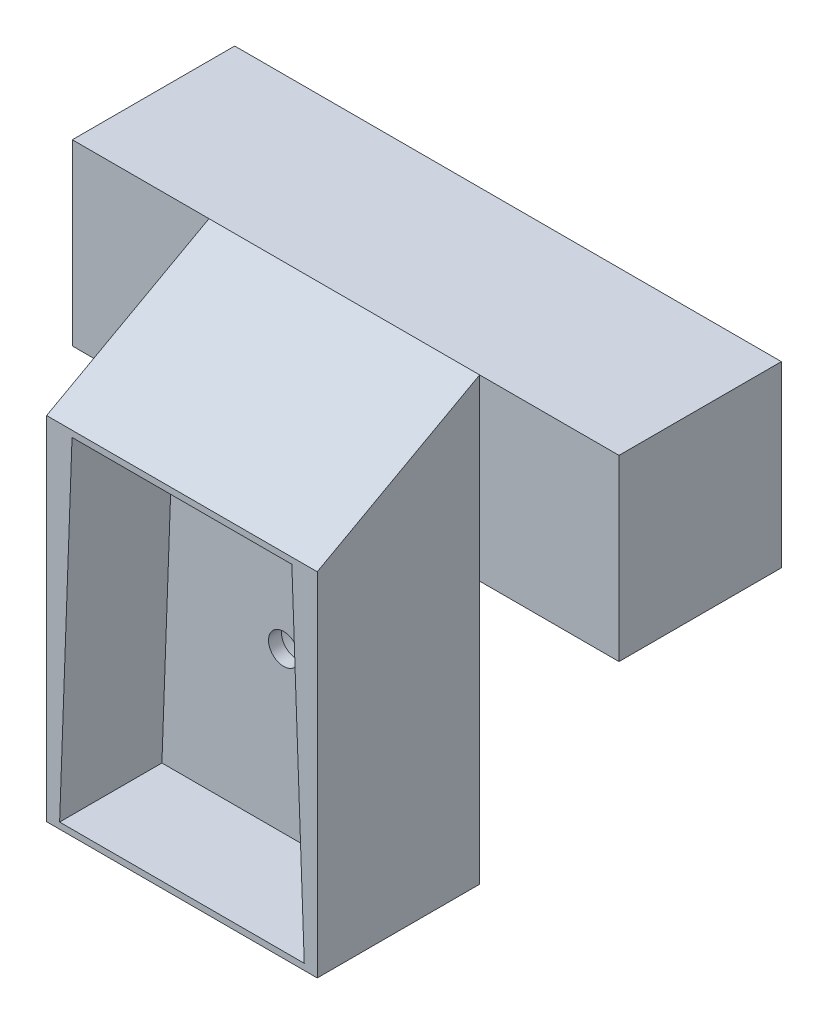
from build123d import *

# Parameters (mm, degrees)
SKICA1_W                 = 101
SKICA1_H                 = 33
P_IDAT_VYSUNUT_M1_DEPTH  = 30
SKICA2_W                 = 50
SKICA2_H                 = 65
P_IDAT_VYSUNUT_M2_DEPTH  = 30
P_IDAT_VYSUNUT_M3_DEPTH  = 50
ODEBRAT_VYSUNUT_M5_DEPTH = 18.9
SKICA17_R                = 2.8
ODEBRAT_VYSUNUT_M6_DEPTH = 14.2
SKICA18_R                = 7.5
ODEBRAT_VYSUNUT_M7_DEPTH = 8.7


with BuildPart() as part:
    # Skica1 → Přidat vysunutím1 (new body)
    with BuildSketch(Plane.XY):
        with Locations((50.5, 16.5)):
            Rectangle(SKICA1_W, SKICA1_H)
    extrude(amount=P_IDAT_VYSUNUT_M1_DEPTH)

    # Skica2 → Přidat vysunutím2 (add)
    with BuildSketch(Plane.XY.offset(30)):
        with Locations((50.25, -16)):
            Rectangle(SKICA2_W, SKICA2_H)
    extrude(amount=P_IDAT_VYSUNUT_M2_DEPTH)

    # Skica3 → Přidat vysunutím3 (add)
    with BuildSketch(Plane.ZY.offset(-25.25)):
        Polygon((30, 33), (60, 16.5), (30, 16.5), align=None)
    extrude(amount=-P_IDAT_VYSUNUT_M3_DEPTH)

    # Skica6 → Odebrat vysunutím5 (cut)
    with BuildSketch(Plane.XY.offset(60)):
        Polygon((29.945, 15.35), (70.555, 15.35), (72.85, -47.35), (27.65, -47.35), align=None)
    extrude(amount=-ODEBRAT_VYSUNUT_M5_DEPTH, mode=Mode.SUBTRACT)

    # Skica17 → Odebrat vysunutím6 (cut)
    with BuildSketch(Plane.XY.offset(41.1)):
        with Locations((50.144115431, -17.85)):
            Circle(SKICA17_R)
    extrude(amount=-ODEBRAT_VYSUNUT_M6_DEPTH, mode=Mode.SUBTRACT)

    # Skica18 → Odebrat vysunutím7 (cut)
    with BuildSketch(Plane(origin=(0, 0, 30), x_dir=(-1, 0, 0), z_dir=(0, 0, -1))):
        with Locations((-50.144115431, -17.85)):
            Circle(SKICA18_R)
    extrude(amount=-ODEBRAT_VYSUNUT_M7_DEPTH, mode=Mode.SUBTRACT)


solid = part.part
